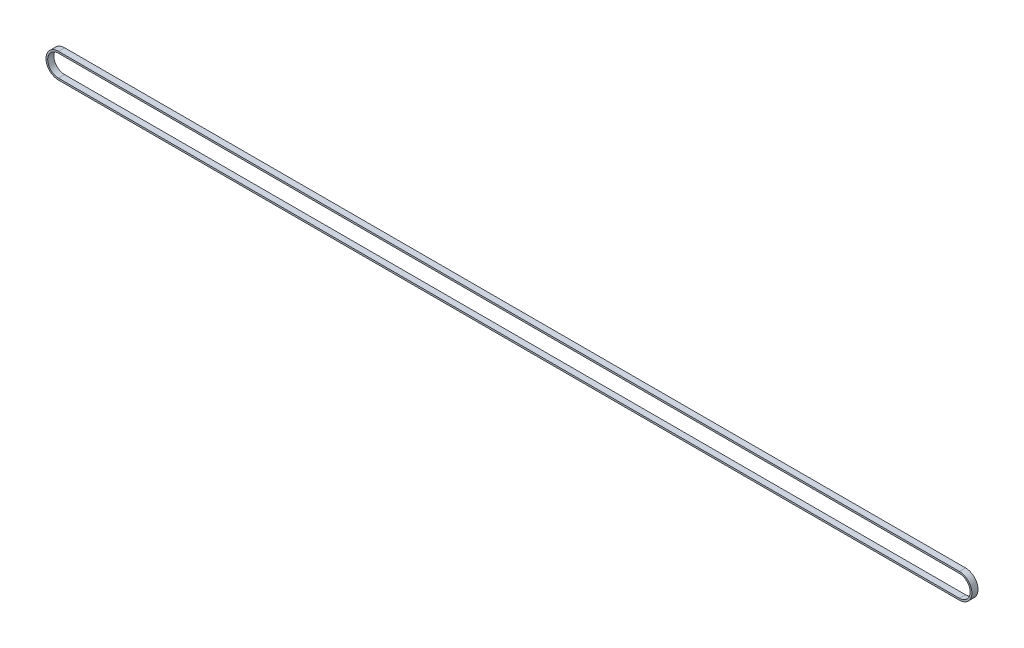
from build123d import *

# Parameters (mm, degrees)
EXTRUDE_THIN1_DEPTH = 2.5


with BuildPart() as part:
    # Sketch1 → Extrude-Thin1 (new, symmetric)
    with BuildSketch(Plane.XY):
        with BuildLine():
            Line((732, -10.13), (0, -10.13))
            ThreePointArc((0, -10.13), (-10.13, 0), (0, 10.13))
            Line((0, 10.13), (732, 10.13))
            ThreePointArc((732, 10.13), (742.13, 0), (732, -10.13))
        make_face()
        with BuildLine():
            Line((732, -8.75), (0, -8.75))
            ThreePointArc((0, -8.75), (-8.75, 0), (0, 8.75))
            Line((0, 8.75), (732, 8.75))
            ThreePointArc((732, 8.75), (740.75, 0), (732, -8.75))
        make_face(mode=Mode.SUBTRACT)
    extrude(amount=EXTRUDE_THIN1_DEPTH, both=True)


solid = part.part
